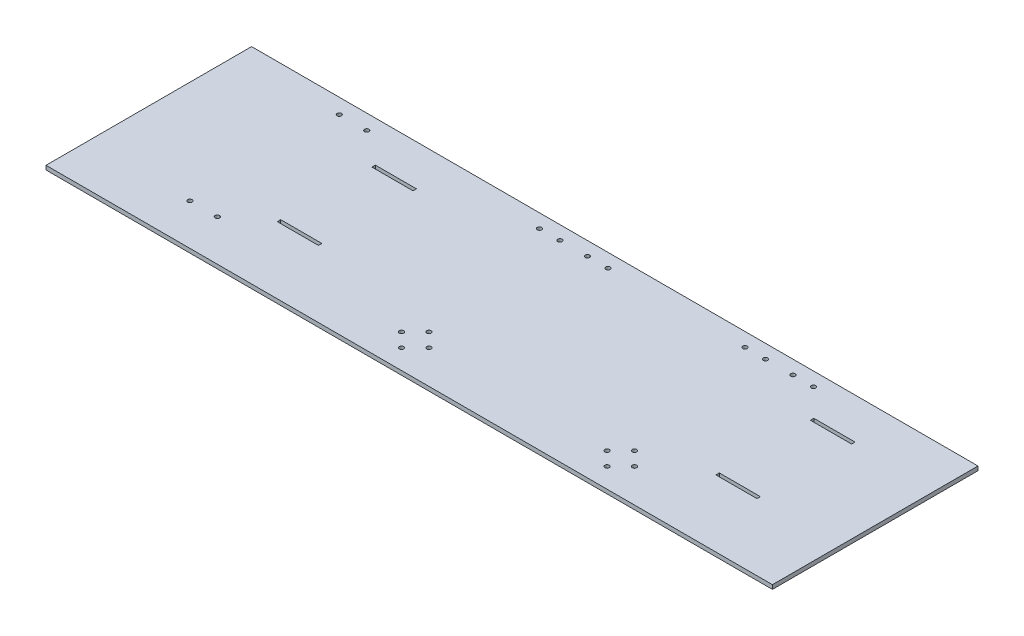
from build123d import *

# Parameters (mm, degrees)
SKETCH_1_R      = 1.6
SKETCH_1_W      = 30
SKETCH_1_H      = 2.5
EXTRUDE_1_DEPTH = 3


with BuildPart() as part:
    # 草图1 → 凸台-拉伸1 (new body)
    with BuildSketch(Plane(origin=(0, 0, 0), x_dir=(1, 0, 0), z_dir=(0, 1, 0))):
        Polygon((-223.132505708, 96.791149389), (246.867494292, 96.791149389), (246.867494292, -53.208850611), (-223.132505708, -53.208850611), (-283.132505708, -53.208850611), (-283.132505708, 96.791149389), align=None)
        with Locations(Location((-208.132505708, -23.208850611, 0), (0, 0, 270))):
            Circle(SKETCH_1_R, mode=Mode.SUBTRACT)
        with Locations(Location((-188.132505708, -23.208850611, 0), (0, 0, 270))):
            Circle(SKETCH_1_R, mode=Mode.SUBTRACT)
        with Locations(Location((-208.132505708, 85.791149389, 0), (0, 0, 90))):
            Circle(SKETCH_1_R, mode=Mode.SUBTRACT)
        with Locations(Location((-188.132505708, 85.791149389, 0), (0, 0, 90))):
            Circle(SKETCH_1_R, mode=Mode.SUBTRACT)
        with Locations(Location((-48.132505708, -28.833850611, 0), (0, 0, 270))):
            Circle(SKETCH_1_R, mode=Mode.SUBTRACT)
        with Locations(Location((-38.132505708, -38.833850611, 0), (0, 0, 270))):
            Circle(SKETCH_1_R, mode=Mode.SUBTRACT)
        with Locations(Location((-28.132505708, -28.833850611, 0), (0, 0, 270))):
            Circle(SKETCH_1_R, mode=Mode.SUBTRACT)
        with Locations(Location((-38.132505708, -18.833850611, 0), (0, 0, 270))):
            Circle(SKETCH_1_R, mode=Mode.SUBTRACT)
        with Locations(Location((101.867494292, -28.833850611, 0), (0, 0, 270))):
            Circle(SKETCH_1_R, mode=Mode.SUBTRACT)
        with Locations(Location((111.867494292, -18.833850611, 0), (0, 0, 270))):
            Circle(SKETCH_1_R, mode=Mode.SUBTRACT)
        with Locations(Location((121.867494292, -28.833850611, 0), (0, 0, 270))):
            Circle(SKETCH_1_R, mode=Mode.SUBTRACT)
        with Locations(Location((111.867494292, -38.833850611, 0), (0, 0, 270))):
            Circle(SKETCH_1_R, mode=Mode.SUBTRACT)
        with Locations(Location((-63.132505708, 86.791149389, 0), (0, 0, 270))):
            Circle(SKETCH_1_R, mode=Mode.SUBTRACT)
        with Locations(Location((-48.132505708, 86.791149389, 0), (0, 0, 270))):
            Circle(SKETCH_1_R, mode=Mode.SUBTRACT)
        with Locations(Location((-28.132505708, 86.791149389, 0), (0, 0, 90))):
            Circle(SKETCH_1_R, mode=Mode.SUBTRACT)
        with Locations(Location((-13.132505708, 86.791149389, 0), (0, 0, 90))):
            Circle(SKETCH_1_R, mode=Mode.SUBTRACT)
        with Locations(Location((86.867494292, 86.791149389, 0), (0, 0, 270))):
            Circle(SKETCH_1_R, mode=Mode.SUBTRACT)
        with Locations(Location((101.867494292, 86.791149389, 0), (0, 0, 270))):
            Circle(SKETCH_1_R, mode=Mode.SUBTRACT)
        with Locations(Location((136.867494292, 86.791149389, 0), (0, 0, 90))):
            Circle(SKETCH_1_R, mode=Mode.SUBTRACT)
        with Locations(Location((121.867494292, 86.791149389, 0), (0, 0, 90))):
            Circle(SKETCH_1_R, mode=Mode.SUBTRACT)
        with Locations((-148.132505708, -3.208850611)):
            Rectangle(SKETCH_1_W, SKETCH_1_H, mode=Mode.SUBTRACT)
        with Locations((171.867494292, -3.208850611)):
            Rectangle(SKETCH_1_W, SKETCH_1_H, mode=Mode.SUBTRACT)
        with Locations((171.867494292, 65.791149389)):
            Rectangle(SKETCH_1_W, SKETCH_1_H, mode=Mode.SUBTRACT)
        with Locations((-148.132505708, 65.791149389)):
            Rectangle(SKETCH_1_W, SKETCH_1_H, mode=Mode.SUBTRACT)
    extrude(amount=EXTRUDE_1_DEPTH)


solid = part.part
